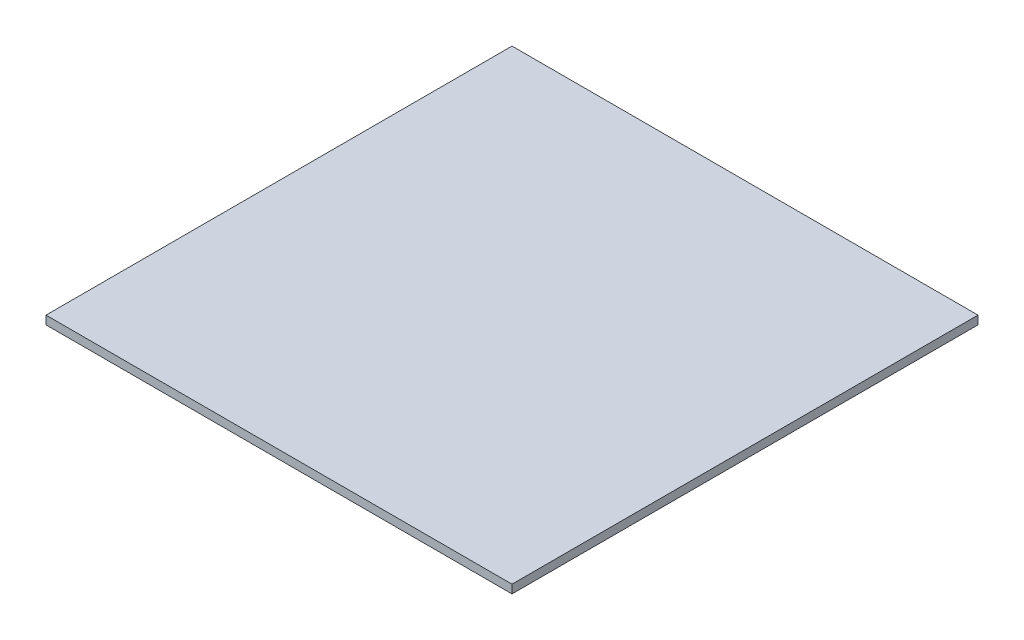
from build123d import *

# Parameters (mm, degrees)
CROQUIS1_W              = 110
CROQUIS1_H              = 2
SALIENTE_EXTRUIR1_DEPTH = 55


with BuildPart() as part:
    # Croquis1 → Saliente-Extruir1 (new, symmetric)
    with BuildSketch(Plane.XY):
        Rectangle(CROQUIS1_W, CROQUIS1_H)
    extrude(amount=SALIENTE_EXTRUIR1_DEPTH, both=True)


solid = part.part
